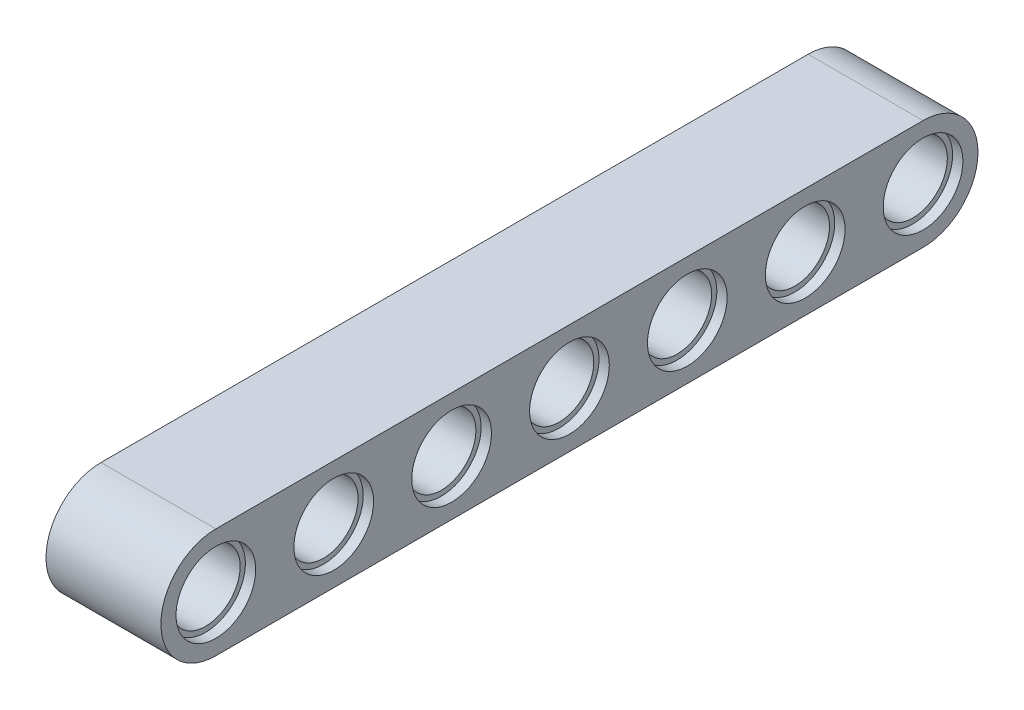
from build123d import *

# Parameters (mm, degrees)
SKETCH1_R           = 2.35
BOSS_EXTRUDE1_DEPTH = 7.8
SKETCH2_R           = 2.705
CUT_EXTRUDE2_DEPTH  = 0.7
CUT_EXTRUDE3_START  = -0.7
SKETCH3_R           = 2.705
CUT_EXTRUDE3_DEPTH  = 0.7


with BuildPart() as part:
    # Sketch1 → Boss-Extrude1 (new body)
    with BuildSketch(Plane(origin=(0, 0, 0), x_dir=(0, 0, -1), z_dir=(1, 0, 0))):
        with BuildLine():
            Line((-24, -3.73), (24, -3.73))
            ThreePointArc((24, -3.73), (27.73, 0), (24, 3.73))
            Line((24, 3.73), (-24, 3.73))
            ThreePointArc((-24, 3.73), (-27.73, 0), (-24, -3.73))
        make_face()
        with Locations((-24, 0)):
            Circle(SKETCH1_R, mode=Mode.SUBTRACT)
        with Locations((-16, 0)):
            Circle(SKETCH1_R, mode=Mode.SUBTRACT)
        with Locations((-8, 0)):
            Circle(SKETCH1_R, mode=Mode.SUBTRACT)
        Circle(SKETCH1_R, mode=Mode.SUBTRACT)
        with Locations((8, 0)):
            Circle(SKETCH1_R, mode=Mode.SUBTRACT)
        with Locations((16, 0)):
            Circle(SKETCH1_R, mode=Mode.SUBTRACT)
        with Locations((24, 0)):
            Circle(SKETCH1_R, mode=Mode.SUBTRACT)
    extrude(amount=BOSS_EXTRUDE1_DEPTH)

    # Sketch2 → Cut-Extrude2 (cut)
    with BuildSketch(Plane.ZY):
        with Locations((-24, 0)):
            Circle(SKETCH2_R)
        with Locations((-16, 0)):
            Circle(SKETCH2_R)
        with Locations((-8, 0)):
            Circle(SKETCH2_R)
        Circle(SKETCH2_R)
        with Locations((8, 0)):
            Circle(SKETCH2_R)
        with Locations((16, 0)):
            Circle(SKETCH2_R)
        with Locations((24, 0)):
            Circle(SKETCH2_R)
    extrude(amount=-CUT_EXTRUDE2_DEPTH, mode=Mode.SUBTRACT)

    # Sketch3 → Cut-Extrude3 (cut)
    with BuildSketch(Plane(origin=(7.8, 0, 0), x_dir=(0, 0, -1), z_dir=(1, 0, 0)).offset(CUT_EXTRUDE3_START)):
        with Locations(Location((-24, 0, 0), (0, 0, 180))):
            Circle(SKETCH3_R)
        with Locations(Location((-16, 0, 0), (0, 0, 180))):
            Circle(SKETCH3_R)
        with Locations(Location((-8, 0, 0), (0, 0, 180))):
            Circle(SKETCH3_R)
        with Locations(Location((0, 0, 0), (0, 0, 180))):
            Circle(SKETCH3_R)
        with Locations(Location((8, 0, 0), (0, 0, 180))):
            Circle(SKETCH3_R)
        with Locations(Location((16, 0, 0), (0, 0, 180))):
            Circle(SKETCH3_R)
        with Locations(Location((24, 0, 0), (0, 0, 180))):
            Circle(SKETCH3_R)
    extrude(amount=CUT_EXTRUDE3_DEPTH, mode=Mode.SUBTRACT)


solid = part.part
